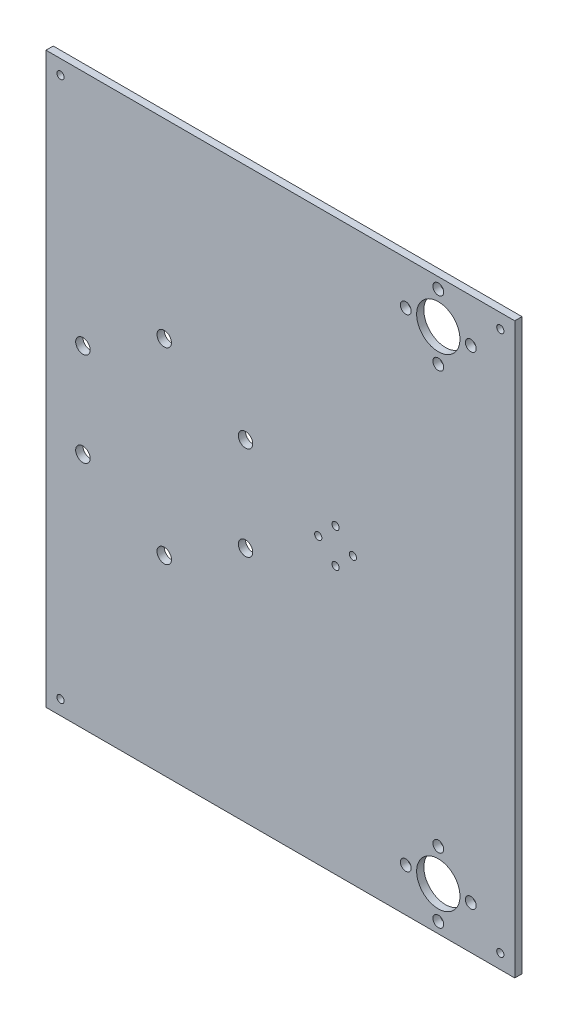
from build123d import *

# Parameters (mm, degrees)
SKETCH1_W           = 324.5
SKETCH1_H           = 394
BOSS_EXTRUDE1_DEPTH = 5
SKETCH2_R           = 2.5
CUT_EXTRUDE1_DEPTH  = 256.262732298
SKETCH4_R           = 5
CUT_EXTRUDE3_DEPTH  = 5
SKETCH5_R           = 2.5
CUT_EXTRUDE4_DEPTH  = 5
SKETCH7_R           = 15
SKETCH7_R_2         = 3.75
CUT_EXTRUDE6_DEPTH  = 256.262732298


with BuildPart() as part:
    # Sketch1 → Boss-Extrude1 (new body)
    with BuildSketch(Plane.XY):
        Rectangle(SKETCH1_W, SKETCH1_H)
    extrude(amount=BOSS_EXTRUDE1_DEPTH)

    # Sketch2 → Cut-Extrude1 (cut, through all)
    with BuildSketch(Plane.XY.offset(5)):
        with Locations((152.25, 187)):
            Circle(SKETCH2_R)
        with Locations((-152.25, 187)):
            Circle(SKETCH2_R)
        with Locations((-152.25, -187)):
            Circle(SKETCH2_R)
        with Locations((152.25, -187)):
            Circle(SKETCH2_R)
    extrude(amount=-CUT_EXTRUDE1_DEPTH, mode=Mode.SUBTRACT)

    # Sketch4 → Cut-Extrude3 (cut)
    with BuildSketch(Plane(origin=(0, 0, 0), x_dir=(-1, 0, 0), z_dir=(0, 0, -1))):
        with Locations((80.422215232, 65)):
            Circle(SKETCH4_R)
        with Locations((136.713866478, 32.5)):
            Circle(SKETCH4_R)
        with Locations((136.713866478, -32.5)):
            Circle(SKETCH4_R)
        with Locations((80.422215232, -65)):
            Circle(SKETCH4_R)
        with Locations((24.130563986, -32.5)):
            Circle(SKETCH4_R)
        with Locations((24.130563986, 32.5)):
            Circle(SKETCH4_R)
    extrude(amount=-CUT_EXTRUDE3_DEPTH, mode=Mode.SUBTRACT)

    # Sketch5 → Cut-Extrude4 (cut)
    with BuildSketch(Plane.XY.offset(5)):
        with Locations((38.192392445, 12)):
            Circle(SKETCH5_R)
        with Locations((50.192392445, 0)):
            Circle(SKETCH5_R)
        with Locations((38.192392445, -12)):
            Circle(SKETCH5_R)
        with Locations((26.192392445, 0)):
            Circle(SKETCH5_R)
    extrude(amount=-CUT_EXTRUDE4_DEPTH, mode=Mode.SUBTRACT)

    # Sketch7 → Cut-Extrude6 (cut, through all)
    with BuildSketch(Plane(origin=(0, 0, 0), x_dir=(-1, 0, 0), z_dir=(0, 0, -1))):
        with Locations((-109.31, 167)):
            Circle(SKETCH7_R)
        with Locations((-109.31, -167)):
            Circle(SKETCH7_R)
        with Locations((-109.31, 189.5)):
            Circle(SKETCH7_R_2)
        with Locations((-109.31, -144.5)):
            Circle(SKETCH7_R_2)
        with Locations((-86.81, -167)):
            Circle(SKETCH7_R_2)
        with Locations((-109.31, -189.5)):
            Circle(SKETCH7_R_2)
        with Locations((-131.81, -167)):
            Circle(SKETCH7_R_2)
        with Locations((-86.81, 167)):
            Circle(SKETCH7_R_2)
        with Locations((-109.31, 144.5)):
            Circle(SKETCH7_R_2)
        with Locations((-131.81, 167)):
            Circle(SKETCH7_R_2)
    extrude(amount=-CUT_EXTRUDE6_DEPTH, mode=Mode.SUBTRACT)


solid = part.part
